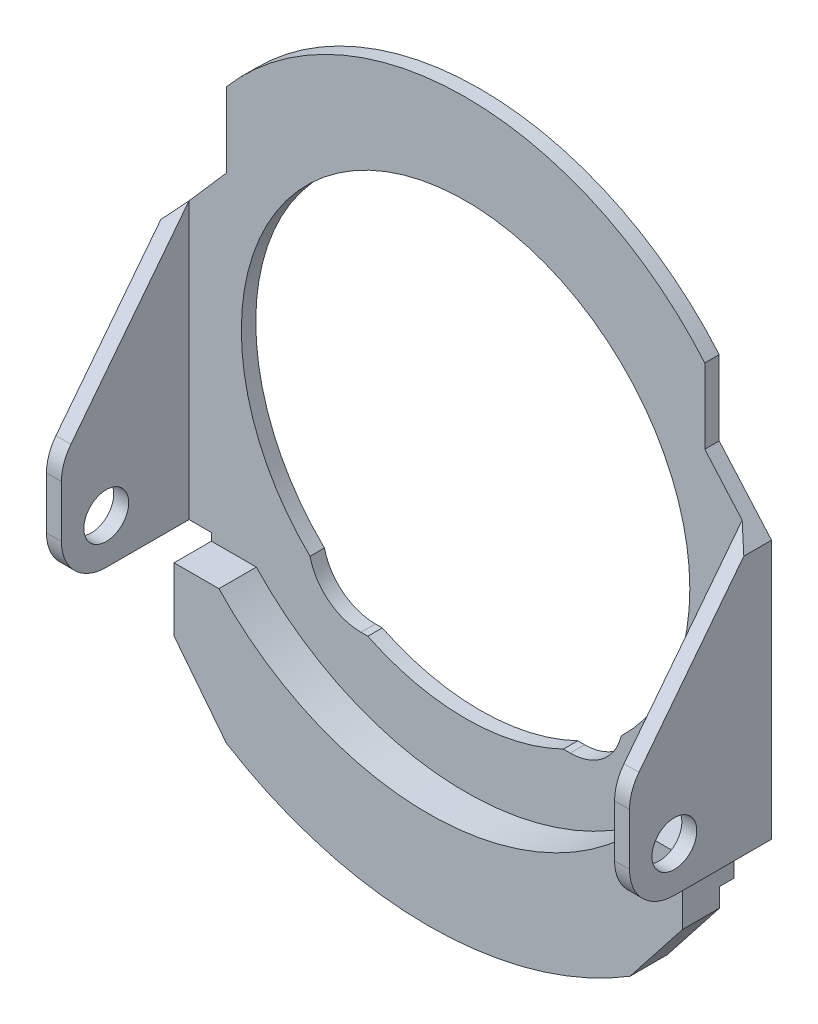
from build123d import *

# Parameters (mm, degrees)
BOSS_EXTRUDE1_DEPTH            = 1.93
BOSS_EXTRUDE2_START            = 1.93
BOSS_EXTRUDE2_DEPTH            = 5
BOSS_EXTRUDE3_DEPTH            = 19
CUT_EXTRUDE1_REACH             = 69.337
CUT_EXTRUDE1_DIRECTION_2_REACH = 69.337
FILLET1_R                      = 6
CUT_EXTRUDE2_REACH             = 69.337
SKETCH5_R                      = 3
CUT_EXTRUDE2_DIRECTION_2_REACH = 69.337


with BuildPart() as part:
    # Sketch1 → Boss-Extrude1 (new body)
    # profile 1 of 4: a face of its own
    with BuildSketch(Plane.XY):
        with BuildLine():
            ThreePointArc((32, 27.202941017), (0, 42), (-32, 27.202941017))
            Line((-32, 27.202941017), (-32, 17.202941017))
            Line((-32, 17.202941017), (-37, 11.488655303))
            Line((-37, 11.488655303), (-37, -25.449961479))
            Line((-37, -25.449961479), (-34, -25.449961479))
            Line((-34, -25.449961479), (-34, -26.449961479))
            Line((-34, -26.449961479), (-28, -26.449961479))
            ThreePointArc((-28, -26.449961479), (0, -38.517534478), (28, -26.449961479))
            Line((28, -26.449961479), (34, -26.449961479))
            Line((34, -26.449961479), (34, -25.449961479))
            Line((34, -25.449961479), (37, -25.449961479))
            Line((37, -25.449961479), (37, 11.488655303))
            Line((37, 11.488655303), (32, 17.202941017))
            Line((32, 17.202941017), (32, 27.202941017))
        make_face()
        with BuildLine():
            Line((-13.076696831, -27), (-14, -27))
            ThreePointArc((-14, -27), (-18.345139389, -25.488147565), (-20.813361759, -21.605646769))
            ThreePointArc((-20.813361759, -21.605646769), (0, 30), (20.813361759, -21.605646769))
            ThreePointArc((20.813361759, -21.605646769), (18.345139389, -25.488147565), (14, -27))
            Line((14, -27), (13.076696831, -27))
            ThreePointArc((13.076696831, -27), (0, -30), (-13.076696831, -27))
        make_face(mode=Mode.SUBTRACT)
    # profile 2 of 4: a face of its own
    with BuildSketch(Plane.XY):
        Polygon((-37, -25.449961479), (-37, 11.488655303), (-39, 9.202941017), (-39, -25.449961479), align=None)
    # profile 3 of 4: a face of its own
    with BuildSketch(Plane.XY):
        Polygon((39, 9.202941017), (37, 11.488655303), (37, -25.449961479), (39, -25.449961479), align=None)
    # profile 4 of 4: a face of its own
    with BuildSketch(Plane.XY):
        with BuildLine():
            Line((-28, -26.449961479), (-34, -26.449961479))
            Line((-34, -26.449961479), (-34, -32.449961479))
            ThreePointArc((-34, -32.449961479), (0, -47), (34, -32.449961479))
            Line((34, -32.449961479), (34, -26.449961479))
            Line((34, -26.449961479), (28, -26.449961479))
            ThreePointArc((28, -26.449961479), (0, -38.517534478), (-28, -26.449961479))
        make_face()
    extrude(amount=BOSS_EXTRUDE1_DEPTH)

    # Sketch1<3> → Boss-Extrude2 (add)
    with BuildSketch(Plane.XY.offset(BOSS_EXTRUDE2_START)):
        with BuildLine():
            Line((-27, -43.854874301), (-34, -34.949961479))
            Line((-34, -34.949961479), (-34, -32.449961479))
            ThreePointArc((-34, -32.449961479), (0, -47), (34, -32.449961479))
            Line((34, -32.449961479), (34, -34.949961479))
            Line((34, -34.949961479), (27, -43.854874301))
            ThreePointArc((27, -43.854874301), (0, -51.5), (-27, -43.854874301))
        make_face()
        with BuildLine():
            Line((-28, -26.449961479), (-34, -26.449961479))
            Line((-34, -26.449961479), (-34, -32.449961479))
            ThreePointArc((-34, -32.449961479), (0, -47), (34, -32.449961479))
            Line((34, -32.449961479), (34, -26.449961479))
            Line((34, -26.449961479), (28, -26.449961479))
            ThreePointArc((28, -26.449961479), (0, -38.517534478), (-28, -26.449961479))
        make_face()
    extrude(amount=BOSS_EXTRUDE2_DEPTH)

    # Sketch1<4> → Boss-Extrude3 (add)
    with BuildSketch(Plane.XY):
        Polygon((-37, -25.449961479), (-37, 11.488655303), (-39, 9.202941017), (-39, -25.449961479), align=None)
        Polygon((39, 9.202941017), (37, 11.488655303), (37, -25.449961479), (39, -25.449961479), align=None)
    extrude(amount=BOSS_EXTRUDE3_DEPTH)

    # Sketch3 → Cut-Extrude1 (cut, up to next)
    with BuildSketch(Plane(origin=(0, 0, 0), x_dir=(0, 0, -1), z_dir=(1, 0, 0)), mode=Mode.PRIVATE) as cut_extrude1_sk1:
        Polygon((-1.93, 11.488655303), (-19, -10.449961479), (-19, 9.202941017), (-19, 11.488655303), align=None)
    cut_extrude1_tool1 = extrude(cut_extrude1_sk1.sketch, amount=-CUT_EXTRUDE1_REACH, mode=Mode.PRIVATE) & part.part
    add(cut_extrude1_tool1.solids().sort_by_distance((0, 4.175783, 13.31))[0], mode=Mode.SUBTRACT)

    # Sketch3 → Cut-Extrude1 direction 2 (cut, up to next)
    with BuildSketch(Plane(origin=(0, 0, 0), x_dir=(0, 0, -1), z_dir=(1, 0, 0)), mode=Mode.PRIVATE) as cut_extrude1_direction_2_sk1:
        Polygon((-1.93, 11.488655303), (-19, -10.449961479), (-19, 9.202941017), (-19, 11.488655303), align=None)
    cut_extrude1_direction_2_tool1 = extrude(cut_extrude1_direction_2_sk1.sketch, amount=CUT_EXTRUDE1_DIRECTION_2_REACH, mode=Mode.PRIVATE) & part.part
    add(cut_extrude1_direction_2_tool1.solids().sort_by_distance((0, 4.175783, 13.31))[0], mode=Mode.SUBTRACT)

    # Fillet1
    fillet1_edges = [part.edges().sort_by_distance(p)[0] for p in [
        (38, -25.449961479, 19),
        (38, -10.449961479, 19),
        (-38, -10.449961479, 19),
        (-38, -25.449961479, 19),
    ]]
    fillet(fillet1_edges, radius=FILLET1_R)

    # Sketch5 → Cut-Extrude2 (cut, up to next)
    with BuildSketch(Plane(origin=(0, 0, 0), x_dir=(0, 0, -1), z_dir=(1, 0, 0)), mode=Mode.PRIVATE) as cut_extrude2_sk1:
        with Locations(Location((-13, -19.449961479, 0), (0, 0, 180))):
            Circle(SKETCH5_R)
    cut_extrude2_tool1 = extrude(cut_extrude2_sk1.sketch, amount=-CUT_EXTRUDE2_REACH, mode=Mode.PRIVATE) & part.part
    add(cut_extrude2_tool1.solids().sort_by_distance((0, -19.449961, 13))[0], mode=Mode.SUBTRACT)

    # Sketch5 → Cut-Extrude2 direction 2 (cut, up to next)
    with BuildSketch(Plane(origin=(0, 0, 0), x_dir=(0, 0, -1), z_dir=(1, 0, 0)), mode=Mode.PRIVATE) as cut_extrude2_direction_2_sk1:
        with Locations(Location((-13, -19.449961479, 0), (0, 0, 180))):
            Circle(SKETCH5_R)
    cut_extrude2_direction_2_tool1 = extrude(cut_extrude2_direction_2_sk1.sketch, amount=CUT_EXTRUDE2_DIRECTION_2_REACH, mode=Mode.PRIVATE) & part.part
    add(cut_extrude2_direction_2_tool1.solids().sort_by_distance((0, -19.449961, 13))[0], mode=Mode.SUBTRACT)


solid = part.part
